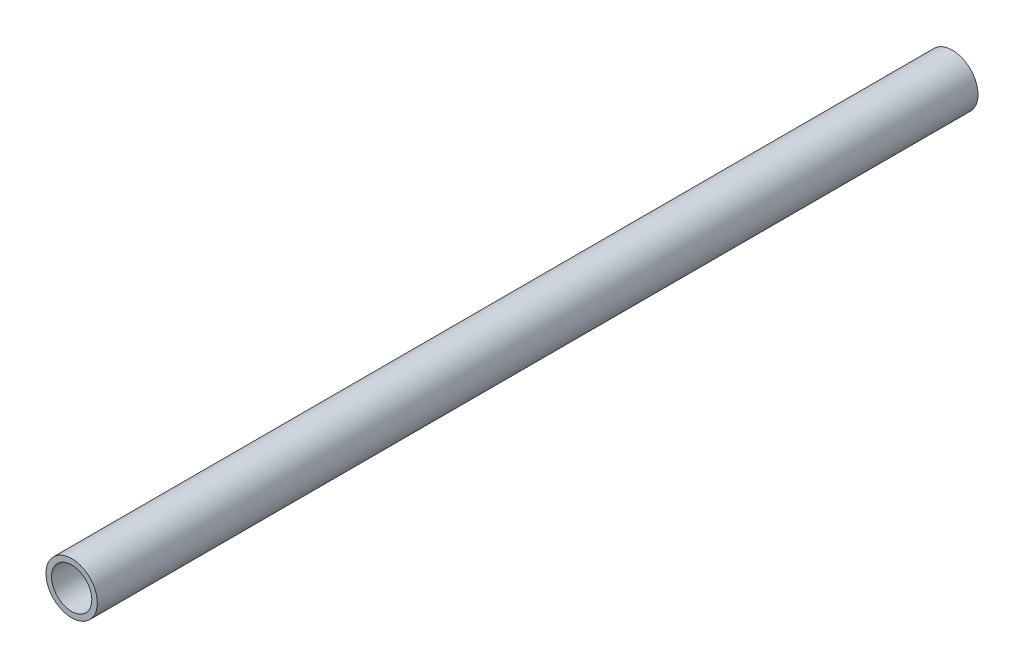
from build123d import *

# Parameters (mm, degrees)
SKETCH1_R           = 13.335
SKETCH1_R_2         = 10.4648
BOSS_EXTRUDE1_DEPTH = 457.2


with BuildPart() as part:
    # Sketch1 → Boss-Extrude1 (new body)
    with BuildSketch(Plane.XY):
        Circle(SKETCH1_R)
        Circle(SKETCH1_R_2, mode=Mode.SUBTRACT)
    extrude(amount=BOSS_EXTRUDE1_DEPTH)


solid = part.part
